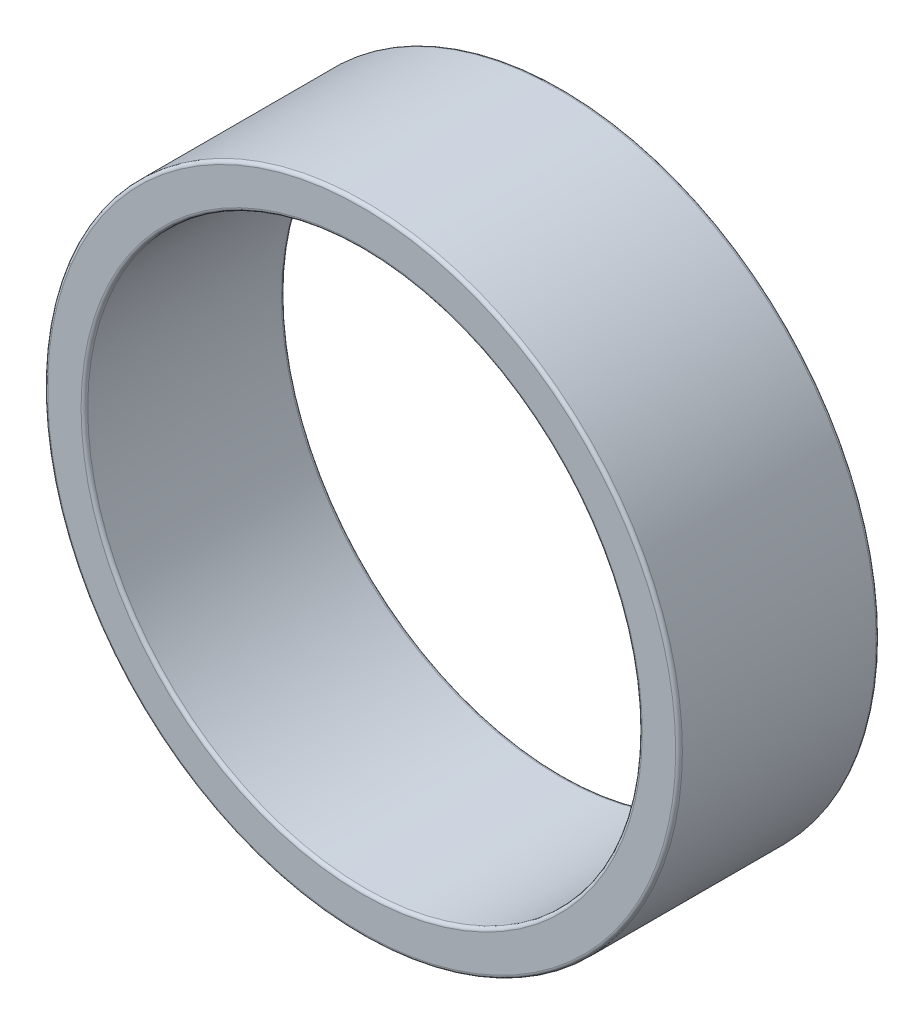
from build123d import *

# Parameters (mm, degrees)
SKETCH1_R           = 9.5
SKETCH1_R_2         = 8.3
BOSS_EXTRUDE1_DEPTH = 6
FILLET1_R           = 0.1


with BuildPart() as part:
    # Sketch1 → Boss-Extrude1 (new body)
    with BuildSketch(Plane.XY):
        Circle(SKETCH1_R)
        Circle(SKETCH1_R_2, mode=Mode.SUBTRACT)
    extrude(amount=BOSS_EXTRUDE1_DEPTH)

    # Fillet1
    fillet1_edges = [part.edges().sort_by_distance(p)[0] for p in [
        (-9.5, 0, 0),
        (-9.5, 0, 6),
        (-8.3, 0, 0),
        (-8.3, 0, 6),
    ]]
    fillet(fillet1_edges, radius=FILLET1_R)


solid = part.part
